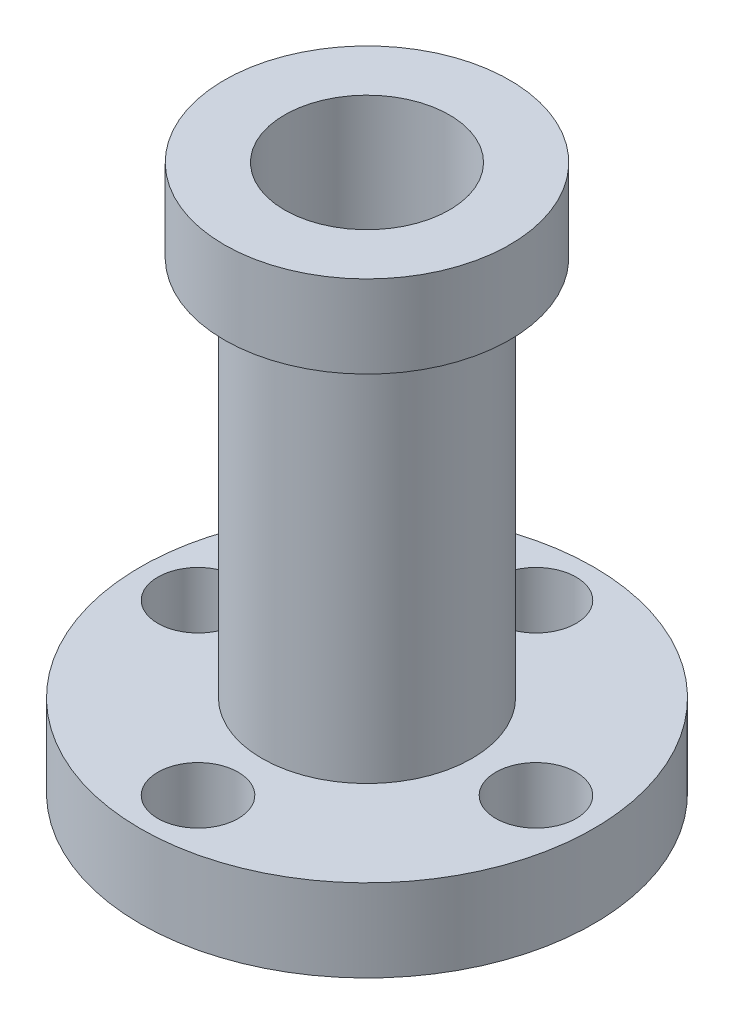
from build123d import *

# Parameters (mm, degrees)
SKETCH1_R           = 11
SKETCH1_R_2         = 1.95
BOSS_EXTRUDE1_DEPTH = 4
SKETCH2_R           = 5.1
BOSS_EXTRUDE2_DEPTH = 18.5
SKETCH3_R           = 6.925
BOSS_EXTRUDE3_DEPTH = 4
SKETCH4_R           = 4
CUT_EXTRUDE1_DEPTH  = 31.728651126


with BuildPart() as part:
    # Sketch1 → Boss-Extrude1 (new body)
    with BuildSketch(Plane(origin=(0, 0, 0), x_dir=(1, 0, 0), z_dir=(0, 1, 0))):
        with Locations(Location((0, 0, 0), (0, 0, 270))):
            Circle(SKETCH1_R)
        with Locations(Location((-8.2, 0, 0), (0, 0, 270))):
            Circle(SKETCH1_R_2, mode=Mode.SUBTRACT)
        with Locations(Location((8.2, 0, 0), (0, 0, 90))):
            Circle(SKETCH1_R_2, mode=Mode.SUBTRACT)
        with Locations(Location((0, 8.2, 0), (0, 0, 270))):
            Circle(SKETCH1_R_2, mode=Mode.SUBTRACT)
        with Locations(Location((0, -8.2, 0), (0, 0, 90))):
            Circle(SKETCH1_R_2, mode=Mode.SUBTRACT)
    extrude(amount=BOSS_EXTRUDE1_DEPTH)

    # Sketch2 → Boss-Extrude2 (add)
    with BuildSketch(Plane(origin=(0, 4, 0), x_dir=(1, 0, 0), z_dir=(0, 1, 0))):
        with Locations(Location((0, 0, 0), (0, 0, 270))):
            Circle(SKETCH2_R)
    extrude(amount=BOSS_EXTRUDE2_DEPTH)

    # Sketch3 → Boss-Extrude3 (add)
    with BuildSketch(Plane(origin=(0, 22.5, 0), x_dir=(1, 0, 0), z_dir=(0, 1, 0))):
        with Locations(Location((0, 0, 0), (0, 0, 270))):
            Circle(SKETCH3_R)
    extrude(amount=BOSS_EXTRUDE3_DEPTH)

    # Sketch4 → Cut-Extrude1 (cut, through all)
    with BuildSketch(Plane(origin=(0, 26.5, 0), x_dir=(1, 0, 0), z_dir=(0, 1, 0))):
        with Locations(Location((0, 0, 0), (0, 0, 270))):
            Circle(SKETCH4_R)
    extrude(amount=-CUT_EXTRUDE1_DEPTH, mode=Mode.SUBTRACT)


solid = part.part
